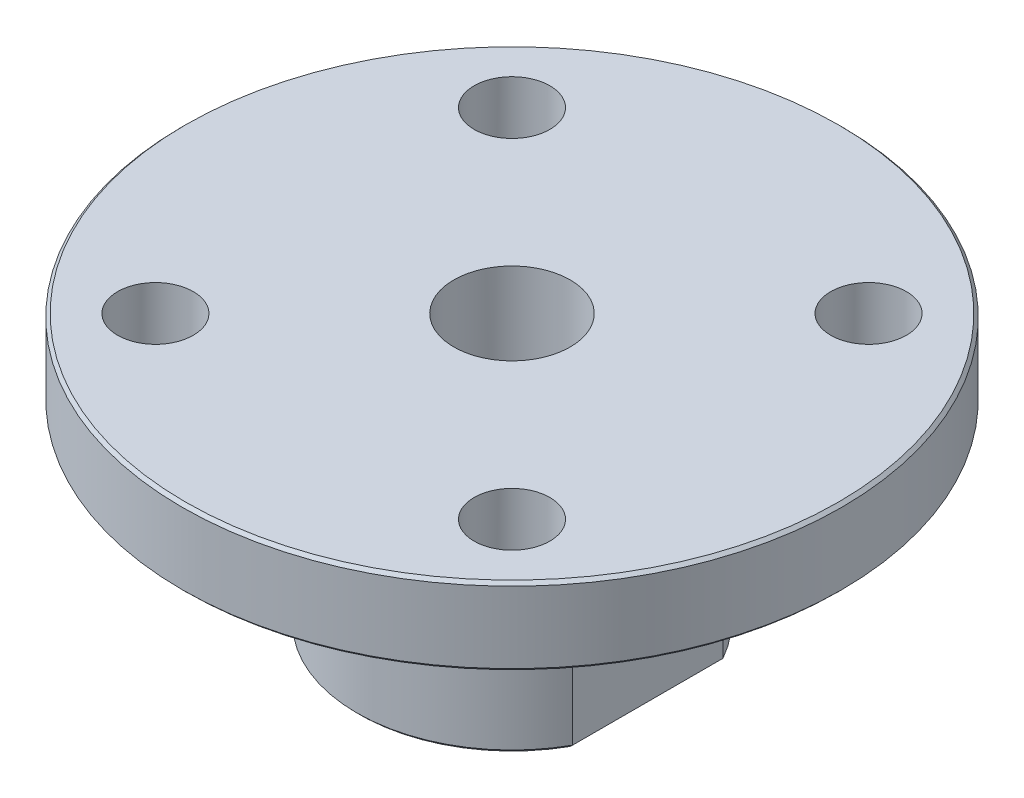
from build123d import *

# Parameters (mm, degrees)
SKETCH2_W          = 1.5875
SKETCH2_H          = 6.148361062
CUT_EXTRUDE1_DEPTH = 7.9375
SKETCH3_R          = 1.55
CUT_EXTRUDE2_DEPTH = 23.082804042
SKETCH4_R          = 1.55
CUT_EXTRUDE3_DEPTH = 23.082804093
CHAMFER1_SIZE      = 0.127
SCALE1_SCALE       = 1.5


with BuildPart() as part:
    # Sketch1 → Revolve1 (revolve)
    with BuildSketch(Plane.XY, mode=Mode.PRIVATE) as revolve1_sk:
        Polygon((6.35, 0), (6.35, 7.9375), (13.49375, 7.9375), (13.49375, 11.1125), (2.38125, 11.1125), (2.38125, 0), align=None)
    revolve(revolve1_sk.sketch.rotate(Axis((0, 0, 0), (0, 1, 0)), 90), axis=Axis((0, 0, 0), (0, 1, 0)))

    # Sketch2 → Cut-Extrude1 (cut)
    with BuildSketch(Plane.XZ):
        with Locations((-6.35, 0)):
            Rectangle(SKETCH2_W, SKETCH2_H)
        with Locations((6.35, 0)):
            Rectangle(SKETCH2_W, SKETCH2_H)
    extrude(amount=-CUT_EXTRUDE1_DEPTH, mode=Mode.SUBTRACT)

    # Sketch3 → Cut-Extrude2 (cut, through all)
    with BuildSketch(Plane(origin=(0, 0, 0), x_dir=(0, 0, -1), z_dir=(1, 0, 0))):
        with Locations((0, 4.7625)):
            Circle(SKETCH3_R)
    extrude(amount=-CUT_EXTRUDE2_DEPTH, mode=Mode.SUBTRACT)

    # Sketch4 → Cut-Extrude3 (cut, through all)
    with BuildSketch(Plane(origin=(0, 11.1125, 0), x_dir=(1, 0, 0), z_dir=(0, 1, 0))):
        with Locations(Location((-7.296458098, 7.296458098, 0), (0, 0, 270))):
            Circle(SKETCH4_R)
        with Locations(Location((7.296458098, 7.296458098, 0), (0, 0, 270))):
            Circle(SKETCH4_R)
        with Locations(Location((7.296458098, -7.296458098, 0), (0, 0, 270))):
            Circle(SKETCH4_R)
        with Locations(Location((-7.296458098, -7.296458098, 0), (0, 0, 270))):
            Circle(SKETCH4_R)
    extrude(amount=-CUT_EXTRUDE3_DEPTH, mode=Mode.SUBTRACT)

    # Chamfer1
    chamfer1_edges = [part.edges().sort_by_distance(p)[0] for p in [
        (0, 0, -6.35),
        (-5.55625, 0, 0),
        (0, 0, 6.35),
        (5.55625, 0, 0),
        (0, 7.9375, 13.49375),
        (0, 11.1125, 13.49375),
    ]]
    chamfer(chamfer1_edges, length=CHAMFER1_SIZE)


with BuildPart() as part_1:
    # Scale1: scaled about (0.039762261, 7.732974778, -1.52e-07)
    add(part.part.scale(SCALE1_SCALE).moved(Location((-0.019881131, -3.866487389, 7.6e-08))))


solid = part_1.part
